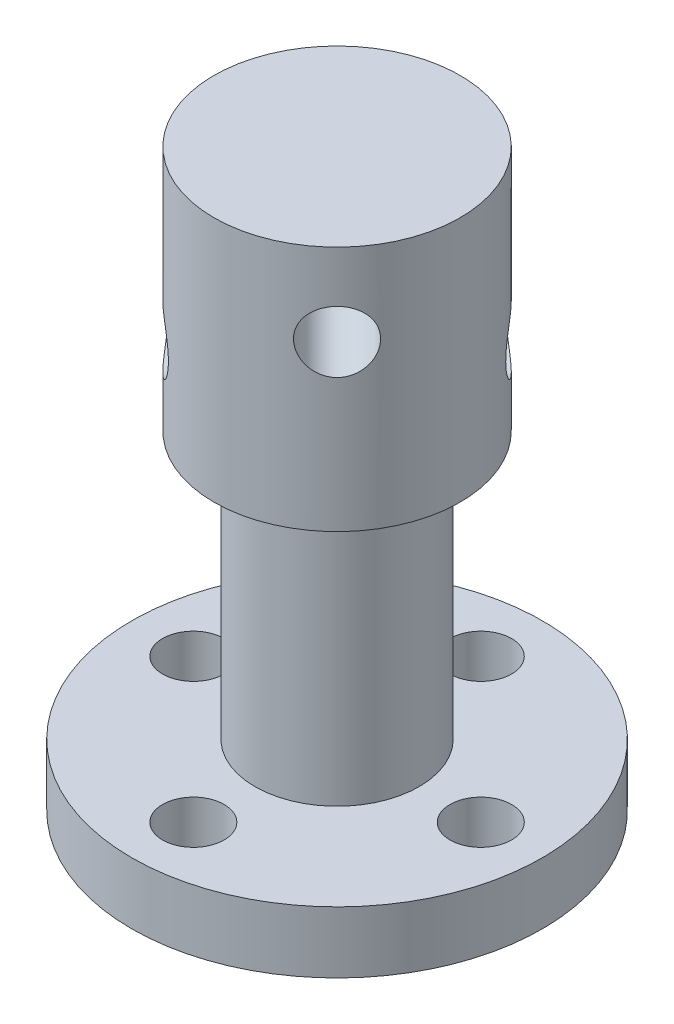
from build123d import *

# Parameters (mm, degrees)
SKETCH_1_R               = 10
SKETCH_1_R_2             = 3
SKETCH_1_R_3             = 1.5
EXTRUDE_1_DEPTH          = 3
SKETCH_2_R               = 4
EXTRUDE_2_DEPTH          = 16
SKETCH_6_R               = 6
EXTRUDE_3_DEPTH          = 12
CUT_EXTRUDE_1_DEPTH      = 32.368774283
CUT_EXTRUDE_1_DEPTH_BACK = 32.368774283
SKETCH_5_R               = 1.5
CUT_EXTRUDE_3_DEPTH      = 32.368774372
CUT_EXTRUDE_3_DEPTH_BACK = 32.368774372
SKETCH_7_R               = 1.5


with BuildPart() as part:
    # 草图1 → 凸台-拉伸1 (new body)
    with BuildSketch(Plane(origin=(0, 0, 0), x_dir=(1, 0, 0), z_dir=(0, 1, 0))):
        Circle(SKETCH_1_R)
        Circle(SKETCH_1_R_2, mode=Mode.SUBTRACT)
        with Locations((0, 7)):
            Circle(SKETCH_1_R_3, mode=Mode.SUBTRACT)
        with Locations((7, 0)):
            Circle(SKETCH_1_R_3, mode=Mode.SUBTRACT)
        with Locations((0, -7)):
            Circle(SKETCH_1_R_3, mode=Mode.SUBTRACT)
        with Locations((-7, 0)):
            Circle(SKETCH_1_R_3, mode=Mode.SUBTRACT)
    extrude(amount=EXTRUDE_1_DEPTH)

    # 草图2 → 凸台-拉伸2 (add)
    with BuildSketch(Plane(origin=(0, 0, 0), x_dir=(1, 0, 0), z_dir=(0, 1, 0))):
        Circle(SKETCH_2_R)
    extrude(amount=EXTRUDE_2_DEPTH)

    # 草图6 → 凸台-拉伸3 (add)
    with BuildSketch(Plane(origin=(0, 16, 0), x_dir=(1, 0, 0), z_dir=(0, 1, 0))):
        Circle(SKETCH_6_R)
    extrude(amount=EXTRUDE_3_DEPTH)

    # 草图5 → 切除-拉伸1 (cut, two sides: drawn at the far end of the back side and taken through both)
    with BuildSketch(Plane(origin=(0, 0, 0), x_dir=(0, 1, 0), z_dir=(0.7071067811865438, 0, -0.7071067811865512)).offset(-CUT_EXTRUDE_1_DEPTH_BACK)):
        with Locations((20, 0)):
            Circle(SKETCH_5_R)
    extrude(amount=CUT_EXTRUDE_1_DEPTH + CUT_EXTRUDE_1_DEPTH_BACK, mode=Mode.SUBTRACT)

    # 草图7 → 切除-拉伸3 (cut, two sides: drawn at the far end of the back side and taken through both)
    with BuildSketch(Plane(origin=(0, 0, 0), x_dir=(0, 1, 0), z_dir=(-0.7071067811865537, 0, -0.7071067811865414)).offset(-CUT_EXTRUDE_3_DEPTH_BACK)):
        with Locations((24, 0)):
            Circle(SKETCH_7_R)
    extrude(amount=CUT_EXTRUDE_3_DEPTH + CUT_EXTRUDE_3_DEPTH_BACK, mode=Mode.SUBTRACT)


solid = part.part
